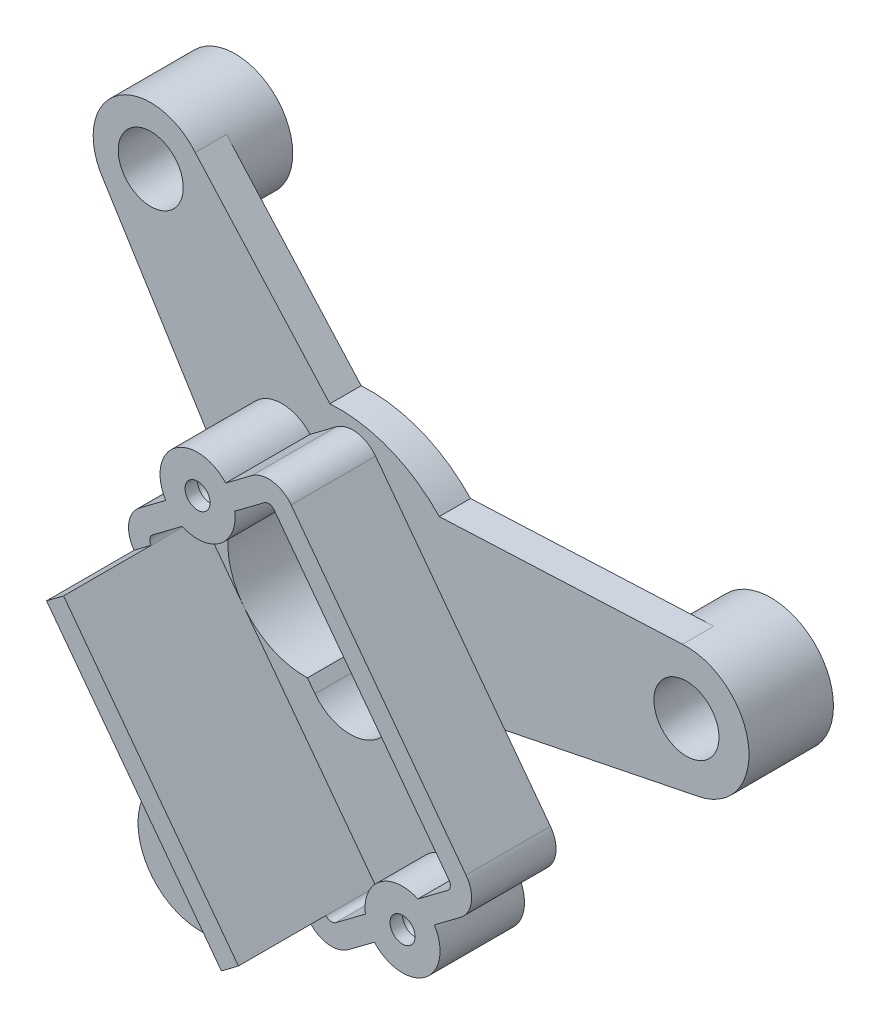
from build123d import *

# Parameters (mm, degrees)
SKETCH1_R                      = 5
BOSS_EXTRUDE1_DEPTH            = 4.25
BOSS_EXTRUDE1_2_DEPTH          = 4.25
SKETCH1_R_2                    = 4.6
BOSS_EXTRUDE1_3_DEPTH          = 4.25
BOSS_EXTRUDE2_DEPTH            = 2.5
BOSS_EXTRUDE3_DEPTH            = 2.75
BOSS_EXTRUDE4_DEPTH            = 4
BOSS_EXTRUDE5_START            = -6.75
SKETCH7_R                      = 3
BOSS_EXTRUDE5_DEPTH            = 6.75
BOSS_EXTRUDE6_DEPTH            = 7
F_2_0_2_DIAMETER_HOLE1_D       = 2
F_2_0_2_DIAMETER_HOLE1_DEPTH   = 1
F_2_0_2_DIAMETER_HOLE1_TIP     = 3.732050808
F_5_2_5_2_DIAMETER_HOLE1_D     = 5.2
F_5_2_5_2_DIAMETER_HOLE1_DEPTH = 41
F_5_2_5_2_DIAMETER_HOLE1_TIP   = 1.562237609


with BuildPart() as part:
    # Sketch1 → Boss-Extrude1 (new body)
    with BuildSketch(Plane.XY):
        with Locations((19.367534606, 34.628988105)):
            Circle(SKETCH1_R)
    extrude(amount=BOSS_EXTRUDE1_DEPTH)



with BuildPart() as body_2:
    # Sketch1 → Boss-Extrude1 2 (new body)
    with BuildSketch(Plane.XY):
        with Locations((-19.466738271, 5.503283448)):
            Circle(SKETCH1_R)
    extrude(amount=BOSS_EXTRUDE1_2_DEPTH)


with BuildPart() as body_3:
    # Sketch1 → Boss-Extrude1 3 (new body)
    with BuildSketch(Plane.XY):
        with Locations((-23.449601832, 51.266135777)):
            Circle(SKETCH1_R_2)
    extrude(amount=BOSS_EXTRUDE1_3_DEPTH)


with BuildPart() as part_1:
    add(part.part)

    add(body_2.part)  # Boss-Extrude2 merges body 2

    add(body_3.part)  # Boss-Extrude2 merges body 3
    # Sketch3 → Boss-Extrude2 (add)
    with BuildSketch(Plane.XY.offset(4.25)):
        with BuildLine():
            Line((-19.895572194, 54.186559261), (-9.131726679, 42.175635572))
            ThreePointArc((-9.131726679, 42.175635572), (-4.375228584, 41.437246463), (-0.389407444, 38.738594493))
            Line((-0.389407444, 38.738594493), (19.051801444, 39.619009405))
            ThreePointArc((19.051801444, 39.619009405), (24.329841267, 35.241778932), (20.275201283, 29.712064148))
            Line((20.275201283, 29.712064148), (1.203848705, 25.836597173))
            ThreePointArc((1.203848705, 25.836597173), (-1.800000005, 22.400000007), (-5.940210923, 20.478552452))
            Line((-5.940210923, 20.478552452), (-14.816024112, 3.667293848))
            ThreePointArc((-14.816024112, 3.667293848), (-21.302727871, 0.852569289), (-24.11745243, 7.339273048))
            Line((-24.11745243, 7.339273048), (-17.566802713, 25.119726319))
            ThreePointArc((-17.566802713, 25.119726319), (-19.323959856, 29.908837282), (-18.731726679, 34.975635572))
            Line((-18.731726679, 34.975635572), (-27.248336676, 48.671985899))
            ThreePointArc((-27.248336676, 48.671985899), (-26.209601832, 54.946135777), (-19.895572194, 54.186559261))
        make_face()
        with BuildLine():
            Line((-8.172170243, 25.06222699), (-7.565580005, 24.253440007))
            ThreePointArc((-7.565580005, 24.253440007), (-5.26029132, 22.888460799), (-2.665020005, 23.553360007))
            ThreePointArc((-2.665020005, 23.553360007), (-1.300040797, 25.858648691), (-1.964940005, 28.453920007))
            Line((-1.964940005, 28.453920007), (-2.571530243, 29.26270699))
            ThreePointArc((-2.571530243, 29.26270699), (-2.337729587, 32.186428603), (-3.486400005, 34.885200007))
            ThreePointArc((-3.486400005, 34.885200007), (-12.085200005, 36.113600007), (-13.313600005, 27.514800007))
            ThreePointArc((-13.313600005, 27.514800007), (-11.044407175, 25.656420412), (-8.172170243, 25.06222699))
        make_face(mode=Mode.SUBTRACT)
    extrude(amount=BOSS_EXTRUDE2_DEPTH)

    # Sketch5 → Boss-Extrude3 (add)
    with BuildSketch(Plane.XY.offset(6.75)):
        with BuildLine():
            Line((8.495879995, 21.742160007), (8.267279995, 22.046960007))
            Line((8.267279995, 22.046960007), (-2.126400462, 35.905200616))
            Line((-2.126400462, 35.905200616), (-5.403000005, 40.274000007))
            Line((-5.403000005, 40.274000007), (-5.479200005, 40.375600007))
            ThreePointArc((-5.479200005, 40.375600007), (-6.963636268, 41.254546165), (-8.634800005, 40.826400007))
            Line((-8.634800005, 40.826400007), (-13.105200005, 37.473600007))
            Line((-13.105200005, 37.473600007), (-17.575600005, 34.120800007))
            ThreePointArc((-17.575600005, 34.120800007), (-18.454546164, 32.636363744), (-18.026400005, 30.965200007))
            Line((-18.026400005, 30.965200007), (-17.950200005, 30.863600007))
            Line((-17.950200005, 30.863600007), (-14.673600388, 26.494800517))
            Line((-14.673600388, 26.494800517), (-4.279920005, 12.636560007))
            Line((-4.279920005, 12.636560007), (-4.051320005, 12.331760007))
            ThreePointArc((-4.051320005, 12.331760007), (-2.566883742, 11.452813848), (-0.895720005, 11.880960007))
            Line((-0.895720005, 11.880960007), (8.045079995, 18.586560007))
            ThreePointArc((8.045079995, 18.586560007), (8.924026154, 20.07099627), (8.495879995, 21.742160007))
        make_face()
        with BuildLine():
            Line((-7.565580005, 24.253440007), (-8.172170243, 25.06222699))
            ThreePointArc((-8.172170243, 25.06222699), (-12.085200005, 36.113600007), (-2.571530243, 29.26270699))
            Line((-2.571530243, 29.26270699), (-1.964940005, 28.453920007))
            ThreePointArc((-1.964940005, 28.453920007), (-2.665020005, 23.553360007), (-7.565580005, 24.253440007))
        make_face(mode=Mode.SUBTRACT)
    extrude(amount=BOSS_EXTRUDE3_DEPTH)

    # Sketch6 → Boss-Extrude4 (add)
    with BuildSketch(Plane.XY.offset(9.5)):
        with BuildLine():
            Line((-8.634800005, 40.826400007), (-13.105200005, 37.473600007))
            Line((-13.105200005, 37.473600007), (-17.575600005, 34.120800007))
            ThreePointArc((-17.575600005, 34.120800007), (-18.454546164, 32.636363744), (-18.026400005, 30.965200007))
            Line((-18.026400005, 30.965200007), (-17.950200005, 30.863600007))
            Line((-17.950200005, 30.863600007), (-14.673600388, 26.494800517))
            Line((-14.673600388, 26.494800517), (-4.279920005, 12.636560007))
            Line((-4.279920005, 12.636560007), (-4.051320005, 12.331760007))
            ThreePointArc((-4.051320005, 12.331760007), (-2.566883742, 11.452813848), (-0.895720005, 11.880960007))
            Line((-0.895720005, 11.880960007), (8.045079995, 18.586560007))
            ThreePointArc((8.045079995, 18.586560007), (8.924026154, 20.07099627), (8.495879995, 21.742160007))
            Line((8.495879995, 21.742160007), (8.267279995, 22.046960007))
            Line((8.267279995, 22.046960007), (-2.126400462, 35.905200616))
            Line((-2.126400462, 35.905200616), (-5.403000005, 40.274000007))
            Line((-5.403000005, 40.274000007), (-5.479200005, 40.375600007))
            ThreePointArc((-5.479200005, 40.375600007), (-6.963636268, 41.254546165), (-8.634800005, 40.826400007))
        make_face()
        with BuildLine():
            Line((6.907279995, 21.026960007), (-3.486400462, 34.885200616))
            Line((-3.486400462, 34.885200616), (-6.763000005, 39.254000007))
            Line((-6.763000005, 39.254000007), (-6.839200005, 39.355600007))
            ThreePointArc((-6.839200005, 39.355600007), (-7.204052574, 39.571632026), (-7.614800005, 39.466400007))
            Line((-7.614800005, 39.466400007), (-12.085200005, 36.113600007))
            Line((-12.085200005, 36.113600007), (-16.555600005, 32.760800007))
            ThreePointArc((-16.555600005, 32.760800007), (-16.771632024, 32.395947438), (-16.666400005, 31.985200007))
            Line((-16.666400005, 31.985200007), (-16.590200005, 31.883600007))
            Line((-16.590200005, 31.883600007), (-13.313600388, 27.514800517))
            Line((-13.313600388, 27.514800517), (-2.919920005, 13.656560007))
            Line((-2.919920005, 13.656560007), (-2.691320005, 13.351760007))
            ThreePointArc((-2.691320005, 13.351760007), (-2.326467436, 13.135727987), (-1.915720005, 13.240960007))
            Line((-1.915720005, 13.240960007), (7.025079995, 19.946560007))
            ThreePointArc((7.025079995, 19.946560007), (7.241112015, 20.311412575), (7.135879995, 20.722160007))
            Line((7.135879995, 20.722160007), (6.907279995, 21.026960007))
        make_face(mode=Mode.SUBTRACT)
    extrude(amount=BOSS_EXTRUDE4_DEPTH)

    # Sketch7 → Boss-Extrude5 (add)
    with BuildSketch(Plane.XY.offset(13.5).offset(BOSS_EXTRUDE5_START)):
        with Locations((-12.956760005, 37.275680007)):
            Circle(SKETCH7_R)
        with Locations((3.426239995, 15.431680007)):
            Circle(SKETCH7_R)
    extrude(amount=BOSS_EXTRUDE5_DEPTH)

    # Sketch8 → Boss-Extrude6 (add)
    with BuildSketch(Plane.XY.offset(13.5)):
        Polygon((-16.666400005, 31.985200007), (-18.026400005, 30.965200007), (-4.051320005, 12.331760007), (-2.691320005, 13.351760007), align=None)
    extrude(amount=BOSS_EXTRUDE6_DEPTH)

    # Ø2.0 (2) Diameter Hole1
    with Locations(Plane.XY.offset(13.5)):
        with Locations((-12.956760005, 37.275680007), (3.426239995, 15.431680007)):
            Hole(F_2_0_2_DIAMETER_HOLE1_D / 2, depth=F_2_0_2_DIAMETER_HOLE1_DEPTH)
            with Locations((0, 0, -(F_2_0_2_DIAMETER_HOLE1_DEPTH + F_2_0_2_DIAMETER_HOLE1_TIP / 2))):  # 30° drill point
                Cone(0, F_2_0_2_DIAMETER_HOLE1_D / 2, F_2_0_2_DIAMETER_HOLE1_TIP, mode=Mode.SUBTRACT)

    # Ø5.2 (5.2) Diameter Hole1
    with Locations(Plane(origin=(-108.726431202, 76.790635104, -28), x_dir=(-0.6000000000000003, 0.7999999999999998, 4.198929075555247e-15), z_dir=(0, 0, -1))):
        with Locations((-110.585697084, 28.635343351), (-71.585697084, 52.906763899), (-110.585697084, 77.178184447)):
            Hole(F_5_2_5_2_DIAMETER_HOLE1_D / 2, depth=F_5_2_5_2_DIAMETER_HOLE1_DEPTH)
            with Locations((0, 0, -(F_5_2_5_2_DIAMETER_HOLE1_DEPTH + F_5_2_5_2_DIAMETER_HOLE1_TIP / 2))):  # 118° drill point
                Cone(0, F_5_2_5_2_DIAMETER_HOLE1_D / 2, F_5_2_5_2_DIAMETER_HOLE1_TIP, mode=Mode.SUBTRACT)


solid = part_1.part
